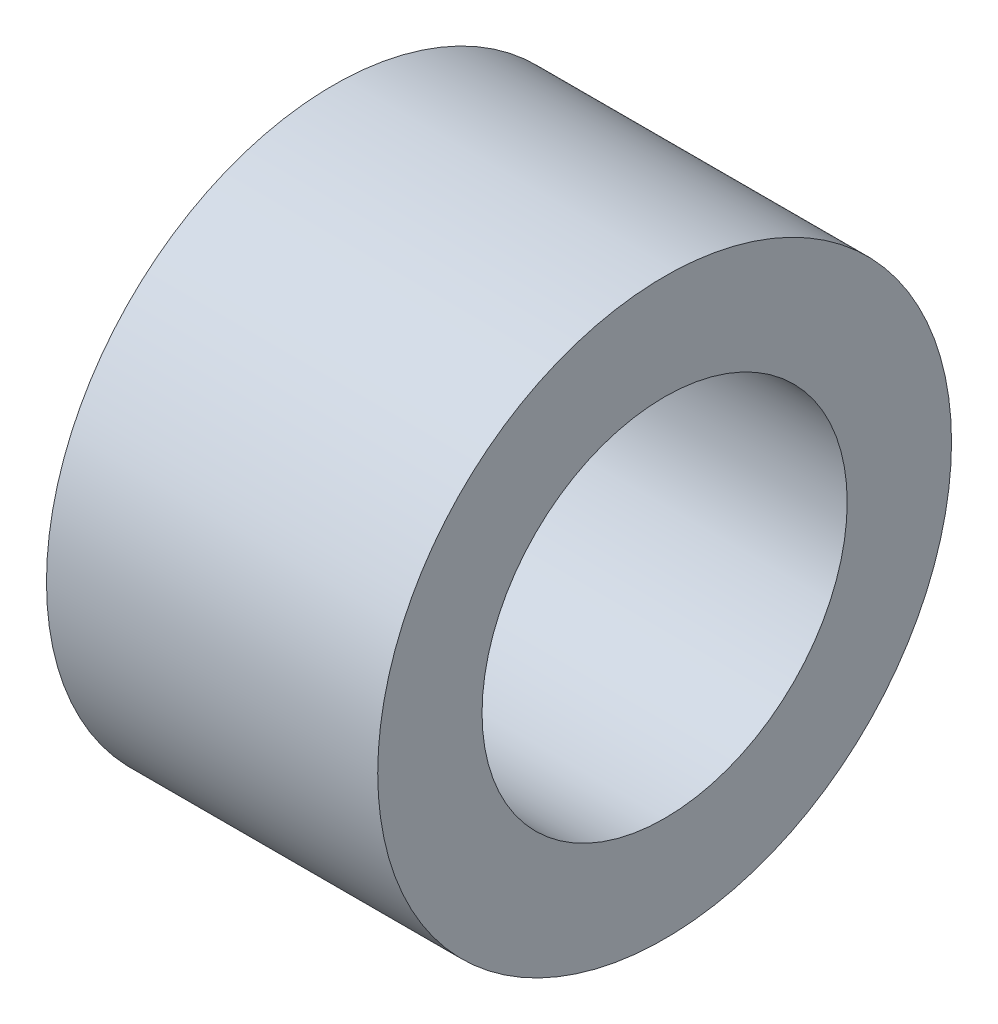
from build123d import *

# Parameters (mm, degrees)
LEG_SPRING_SKETCH_W = 12.7
LEG_SPRING_SKETCH_H = 4


with BuildPart() as part:
    # Leg_Spring Sketch → Leg_Spring (revolve)
    with BuildSketch(Plane.XY):
        with Locations((6.35, 9)):
            Rectangle(LEG_SPRING_SKETCH_W, LEG_SPRING_SKETCH_H)
    revolve(axis=Axis((-3000, 0, 0), (1, 0, 0)))


solid = part.part
